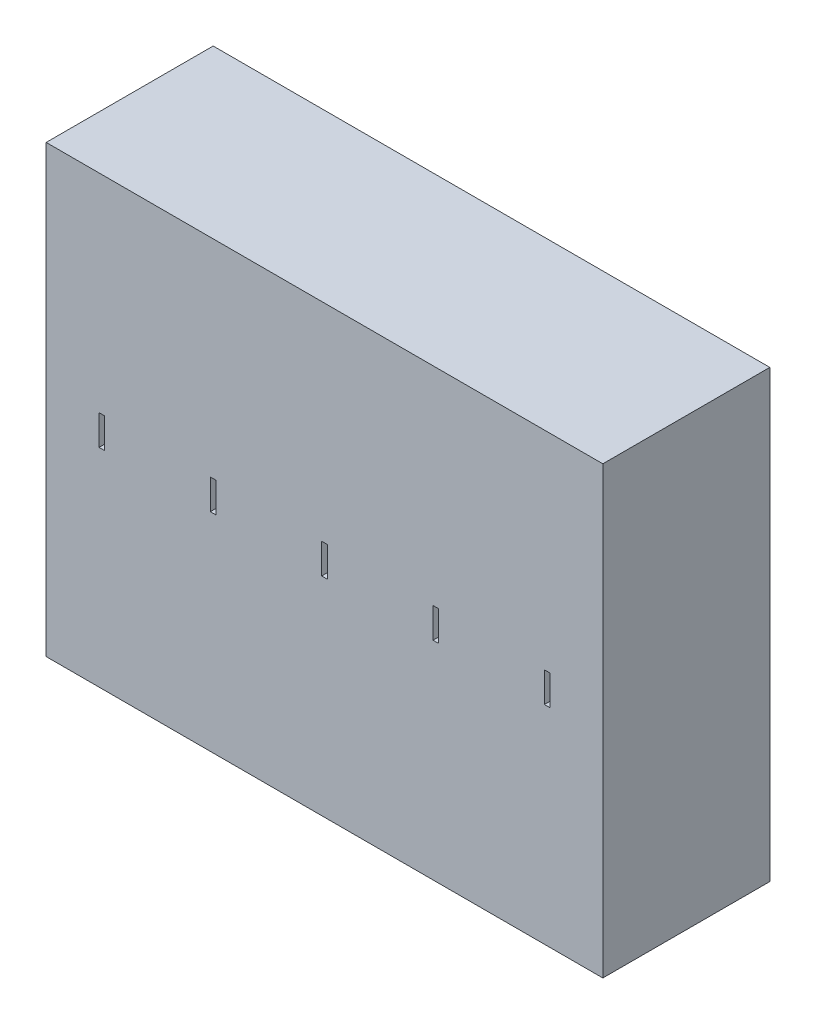
from build123d import *

# Parameters (mm, degrees)
SKIZZE1_W                       = 5
SKIZZE1_H                       = 4
AUFSATZ_LINEAR_AUSTRAGEN1_DEPTH = 1.5
SKIZZE2_W                       = 0.05
SKIZZE2_H                       = 0.27
SCHNITT_LINEAR_AUSTRAGEN1_DEPTH = 0.2
LINEARES_MUSTER1_COUNT          = 5
LINEARES_MUSTER1_PITCH          = 1


with BuildPart() as part:
    # Skizze1 → Aufsatz-Linear austragen1 (new body)
    with BuildSketch(Plane.XY):
        Rectangle(SKIZZE1_W, SKIZZE1_H)
    extrude(amount=AUFSATZ_LINEAR_AUSTRAGEN1_DEPTH)

    # Skizze2 → Schnitt-Linear austragen1 (cut)
    with BuildSketch(Plane.XY.offset(1.5)):
        with Locations((-2, 0)):
            Rectangle(SKIZZE2_W, SKIZZE2_H)
    schnitt_linear_austragen1 = extrude(amount=-SCHNITT_LINEAR_AUSTRAGEN1_DEPTH, mode=Mode.SUBTRACT)

    # Lineares Muster1: Schnitt-Linear austragen1 ×5
    with Locations(*[(i * LINEARES_MUSTER1_PITCH, 0, 0) for i in range(1, LINEARES_MUSTER1_COUNT)]):
        add(schnitt_linear_austragen1, mode=Mode.SUBTRACT)


solid = part.part
